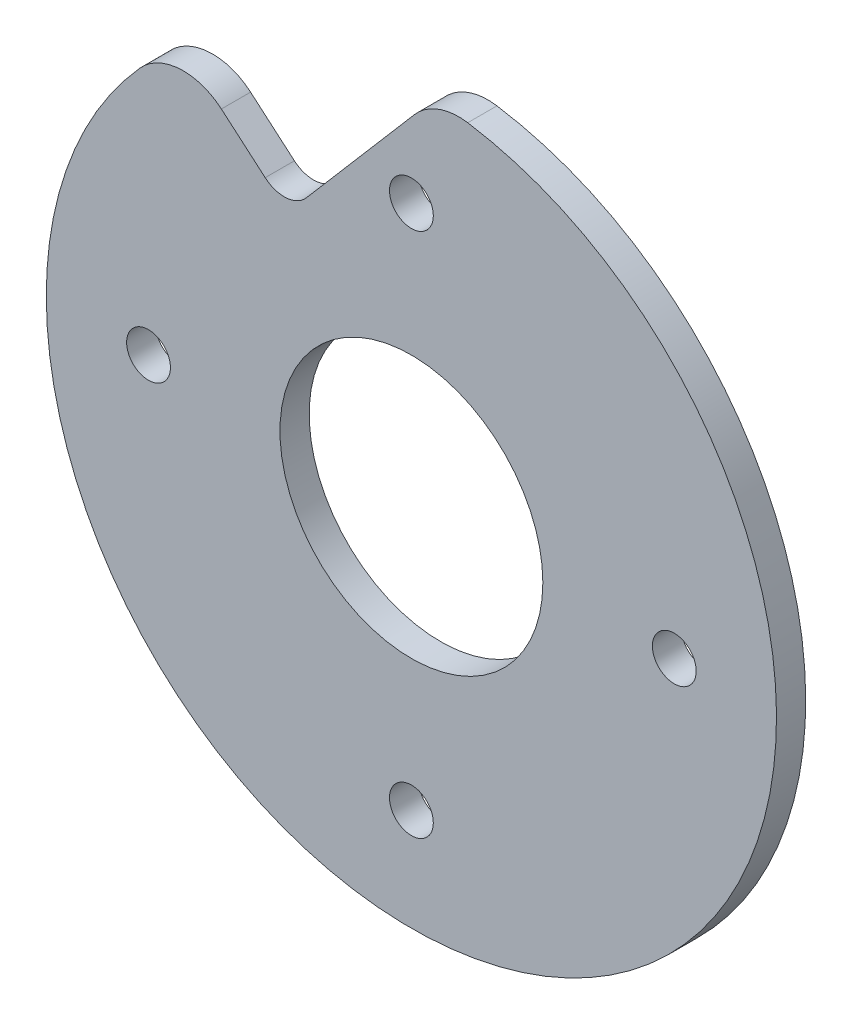
from build123d import *

# Parameters (mm, degrees)
MODEL_R         = 1.5
MODEL_R_2       = 9
EXTRUDE_1_DEPTH = 2


with BuildPart() as part:
    # Model → 凸台-拉伸1 (new body)
    with BuildSketch(Plane.XY):
        with BuildLine():
            Line((0.203212392, 23.351643478), (-7.191181553, 14.724665579))
            ThreePointArc((-7.191181553, 14.724665579), (-8.556294423, 14.032124893), (-10.011275206, 14.507705245))
            Line((-10.011275206, 14.507705245), (-13.011488382, 17.079261403))
            ThreePointArc((-13.011488382, 17.079261403), (-15.873946091, 18.033792422), (-18.588835359, 16.71691359))
            ThreePointArc((-18.588835359, 16.71691359), (8.377839615, -23.554443389), (3.857459976, 24.700607331))
            ThreePointArc((3.857459976, 24.700607331), (1.855038258, 24.500995075), (0.203212392, 23.351643478))
        make_face()
        with Locations((-18, 0)):
            Circle(MODEL_R, mode=Mode.SUBTRACT)
        with Locations((18, 0)):
            Circle(MODEL_R, mode=Mode.SUBTRACT)
        Circle(MODEL_R_2, mode=Mode.SUBTRACT)
        with Locations((0, 18)):
            Circle(MODEL_R, mode=Mode.SUBTRACT)
        with Locations((0, -18)):
            Circle(MODEL_R, mode=Mode.SUBTRACT)
    extrude(amount=EXTRUDE_1_DEPTH)


solid = part.part
